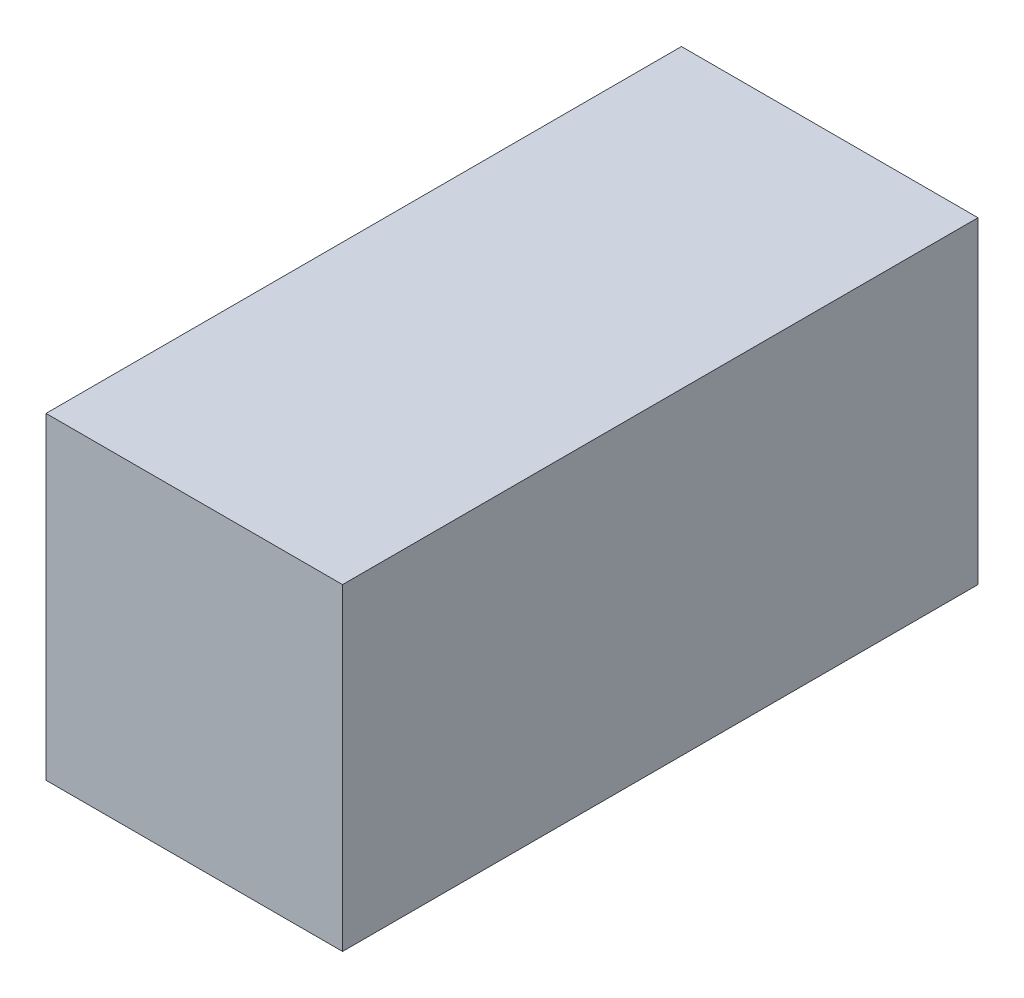
from build123d import *

# Parameters (mm, degrees)
STORE_KLAPE_KASET_KATI_DONMUS_KAP_3_1_START = -100
SKETCH1_W                                   = 140
SKETCH1_H                                   = 150
STORE_KLAPE_KASET_KATI_DONMUS_KAP_3_1_DEPTH = 300


with BuildPart() as part:
    # Sketch1 → STORE_klape_kaset_kati_donmus_kap_3_1 (new body)
    with BuildSketch(Plane.XY.offset(STORE_KLAPE_KASET_KATI_DONMUS_KAP_3_1_START)):
        with Locations((450, 480)):
            Rectangle(SKETCH1_W, SKETCH1_H)
    extrude(amount=-STORE_KLAPE_KASET_KATI_DONMUS_KAP_3_1_DEPTH)


solid = part.part
